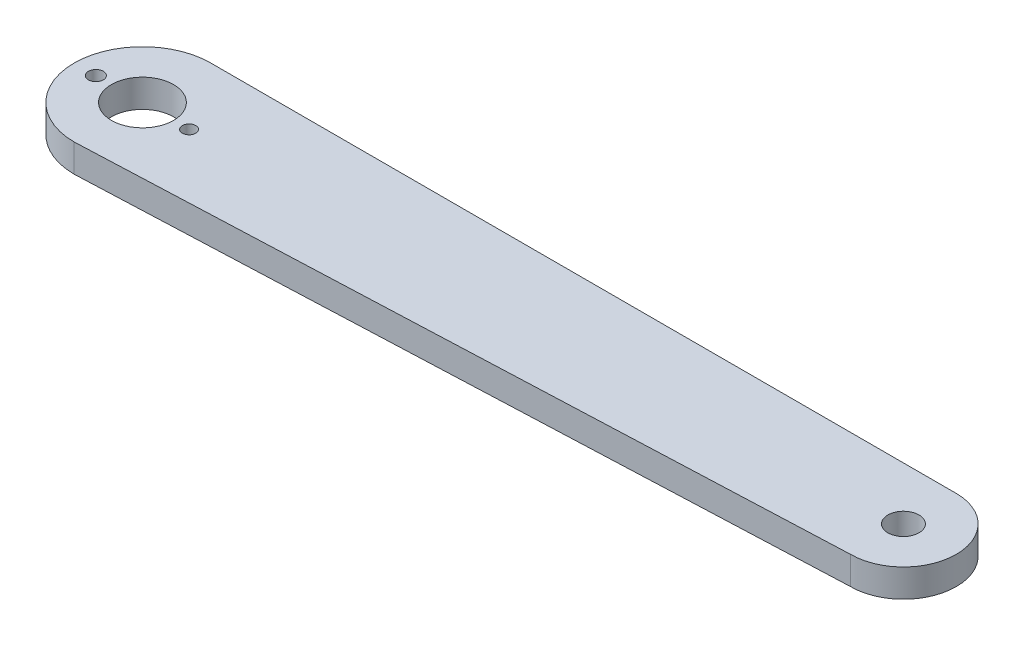
from build123d import *

# Parameters (mm, degrees)
SKETCH1_R           = 5
SKETCH1_R_2         = 1.076155189
SKETCH1_R_3         = 1.201226456
SKETCH1_R_4         = 2.5
BOSS_EXTRUDE2_DEPTH = 4.5


with BuildPart() as part:
    # Sketch1 → Boss-Extrude2 (new body)
    with BuildSketch(Plane(origin=(0, 0, 0), x_dir=(1, 0, 0), z_dir=(0, 1, 0))):
        with BuildLine():
            Line((0, 8.5), (-119.973955507, 8.5))
            ThreePointArc((-119.973955507, 8.5), (-130.973955507, -2.5), (-119.973955507, -13.5))
            Line((-119.973955507, -13.5), (0, -8.5))
            ThreePointArc((0, -8.5), (8.5, 0), (0, 8.5))
        make_face()
        with Locations(Location((-119.973955507, -2.5, 0), (0, 0, 270))):
            Circle(SKETCH1_R, mode=Mode.SUBTRACT)
        with Locations(Location((-112.473955507, -2.5, 0), (0, 0, 270))):
            Circle(SKETCH1_R_2, mode=Mode.SUBTRACT)
        with Locations(Location((-127.473955507, -2.5, 0), (0, 0, 270))):
            Circle(SKETCH1_R_3, mode=Mode.SUBTRACT)
        with Locations(Location((0, 0, 0), (0, 0, 270))):
            Circle(SKETCH1_R_4, mode=Mode.SUBTRACT)
    extrude(amount=BOSS_EXTRUDE2_DEPTH)


solid = part.part
